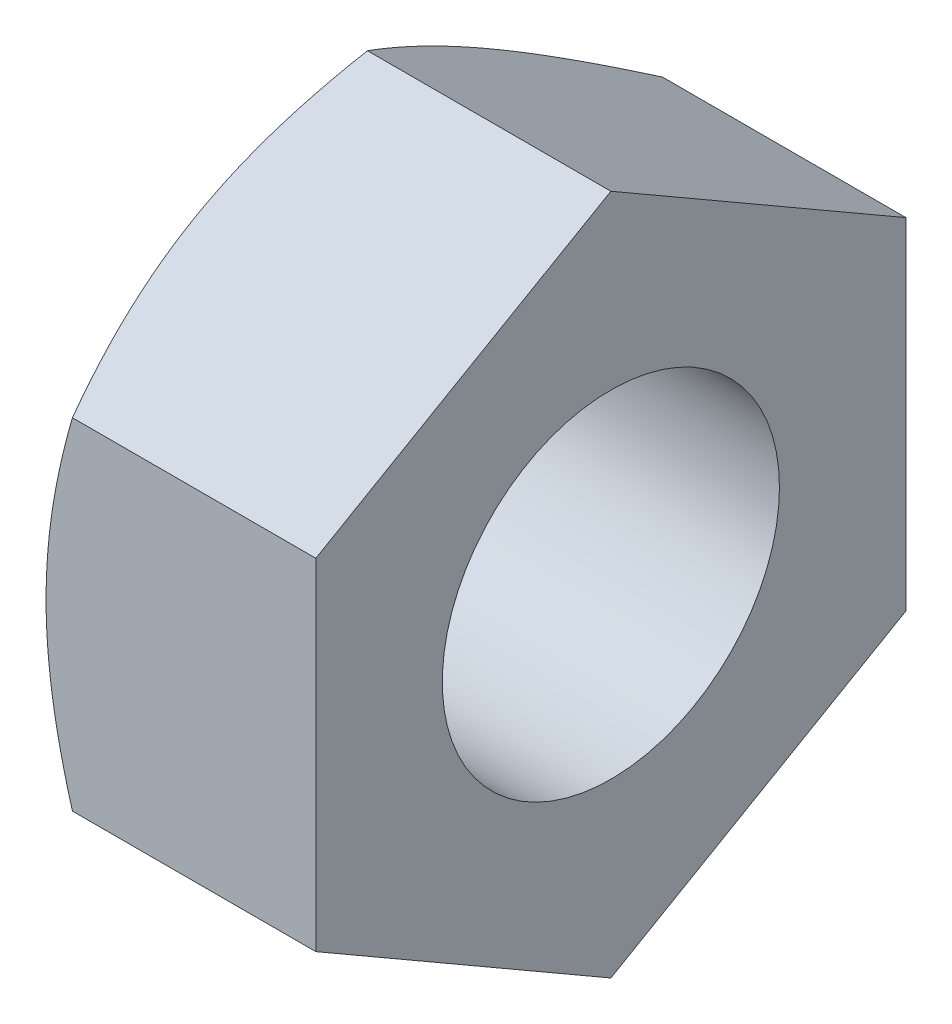
from build123d import *

# Parameters (mm, degrees)
BOSS_EXTRUDE1_DEPTH = 3.2
SKETCH7_R           = 2
CUT_EXTRUDE1_DEPTH  = 7.23083729


with BuildPart() as part:
    # Sketch1 → Boss-Extrude1 (new body)
    with BuildSketch(Plane(origin=(0, 0, 0), x_dir=(0, 0, -1), z_dir=(1, 0, 0))):
        Polygon((0, 4.041451884), (-3.5, 2.020725942), (-3.5, -2.020725942), (0, -4.041451884), (3.5, -2.020725942), (3.5, 2.020725942), align=None)
    extrude(amount=-BOSS_EXTRUDE1_DEPTH)

    # Sketch2 → Cut-Revolve1 (revolve, cut)
    with BuildSketch(Plane.XY):
        Polygon((-3.2, 3.5), (-2.887392609, 4.041451884), (-3.2, 4.041451884), align=None)
    revolve(axis=Axis((-2.23854625, 0, 0), (1, 0, 0)), mode=Mode.SUBTRACT)

    # Sketch7 → Cut-Extrude1 (cut, through all)
    with BuildSketch(Plane(origin=(0, 0, 0), x_dir=(0, 0, -1), z_dir=(1, 0, 0))):
        Circle(SKETCH7_R)
    extrude(amount=-CUT_EXTRUDE1_DEPTH, mode=Mode.SUBTRACT)


solid = part.part
